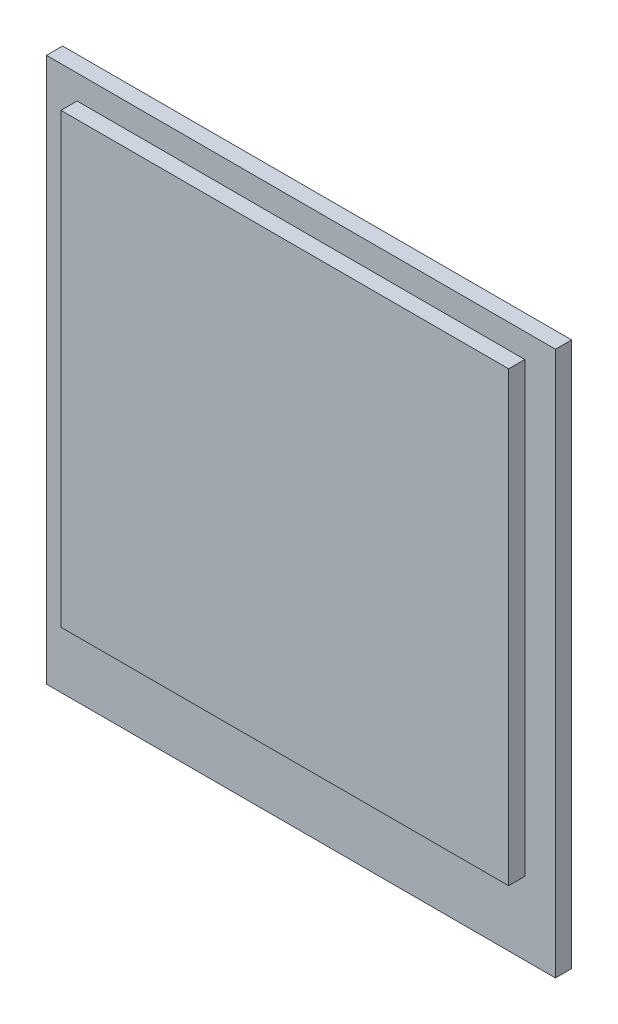
from build123d import *

# Parameters (mm, degrees)
EXTRUDE_1_DEPTH      = 1
EXTRUDE_1_DEPTH_BACK = 1
SKETCH_1_W           = 27.72
SKETCH_1_H           = 27.72
SKETCH_1_5_W         = 31.52
SKETCH_1_5_H         = 33.72
SKETCH_1_5_W_2       = 27.72
SKETCH_1_5_H_2       = 27.72
EXTRUDE_3_DEPTH      = 1


with BuildPart() as part:
    # 草图1 → 凸台-拉伸1 (new, two sides: drawn at the far end of the back side and taken through both)
    with BuildSketch(Plane.XY.offset(-EXTRUDE_1_DEPTH_BACK)):
        Rectangle(SKETCH_1_W, SKETCH_1_H)
    extrude(amount=EXTRUDE_1_DEPTH + EXTRUDE_1_DEPTH_BACK)

    # 草图1<5> → 凸台-拉伸3 (add)
    with BuildSketch(Plane.XY):
        with Locations((0, -1.5)):
            Rectangle(SKETCH_1_5_W, SKETCH_1_5_H)
        Rectangle(SKETCH_1_5_W_2, SKETCH_1_5_H_2, mode=Mode.SUBTRACT)
    extrude(amount=-EXTRUDE_3_DEPTH)


solid = part.part
